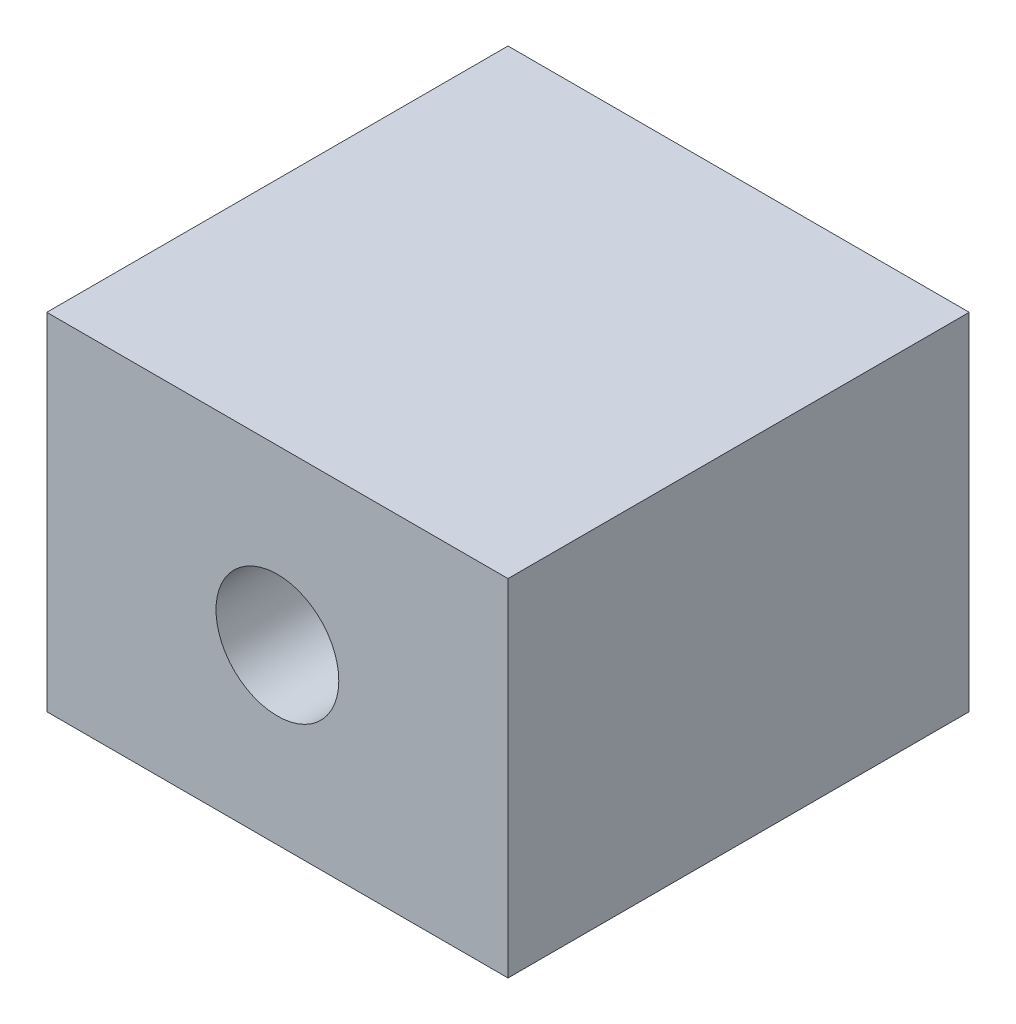
from build123d import *

# Parameters (mm, degrees)
SKETCH1_W             = 12.7
SKETCH1_H             = 10.16
BOSS_EXTRUDE1_DEPTH   = 7.62
SKETCH11_W            = 2.54
SKETCH11_H            = 7.62
CUT_EXTRUDE1_DEPTH    = 27.583545687
F_6_32_TAPPED_HOLE1_D = 2.7051


with BuildPart() as part:
    # Sketch1 → Boss-Extrude1 (new body)
    with BuildSketch(Plane(origin=(0, 0, 0), x_dir=(1, 0, 0), z_dir=(0, 1, 0))):
        with Locations((17.003691385, -2.54)):
            Rectangle(SKETCH1_W, SKETCH1_H)
    extrude(amount=BOSS_EXTRUDE1_DEPTH)

    # Sketch11 → Cut-Extrude1 (cut, through all)
    with BuildSketch(Plane.XY.offset(7.62)):
        with Locations((11.923691385, 3.81)):
            Rectangle(SKETCH11_W, SKETCH11_H)
    extrude(amount=-CUT_EXTRUDE1_DEPTH, mode=Mode.SUBTRACT)

    # #6-32 Tapped Hole1 (through all)
    with Locations(Plane.XY.offset(7.62)):
        with Locations((18.273691385, 3.81)):
            Hole(F_6_32_TAPPED_HOLE1_D / 2)


solid = part.part
